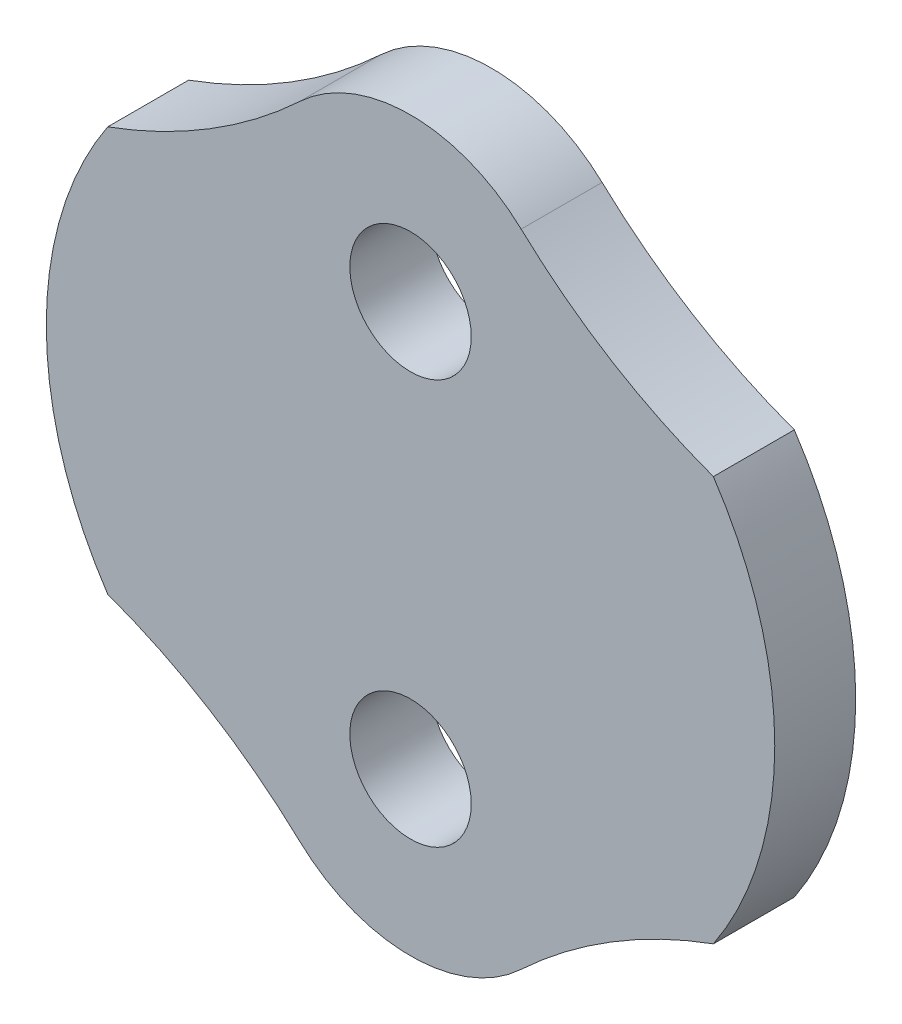
from build123d import *

# Parameters (mm, degrees)
SKETCH1_R           = 14.2875
SKETCH1_R_2         = 2.38125
BOSS_EXTRUDE1_DEPTH = 3.175
SKETCH2_R           = 18.832202279
SKETCH2_R_2         = 14.2875
CUT_EXTRUDE1_DEPTH  = 21.453506729


with BuildPart() as part:
    # Sketch1 → Boss-Extrude1 (new body)
    with BuildSketch(Plane.XY):
        Circle(SKETCH1_R)
        with Locations((0, 7.9375)):
            Circle(SKETCH1_R_2, mode=Mode.SUBTRACT)
        with Locations((0, -7.9375)):
            Circle(SKETCH1_R_2, mode=Mode.SUBTRACT)
    extrude(amount=BOSS_EXTRUDE1_DEPTH)

    # Sketch2 → Cut-Extrude1 (cut, through all)
    # profile 1 of 5: a face of its own
    with BuildSketch(Plane.XY.offset(3.175)):
        Circle(SKETCH2_R)
        Circle(SKETCH2_R_2, mode=Mode.SUBTRACT)
    # profile 2 of 5: a face of its own
    with BuildSketch(Plane.XY.offset(3.175)):
        with BuildLine():
            ThreePointArc((4.340071127, 12.572829828), (7.875864823, 9.874463076), (11.879762203, 7.9375))
            ThreePointArc((11.879762203, 7.9375), (6.735192091, 12.600390619), (0, 14.2875))
            ThreePointArc((0, 14.2875), (2.333254764, 13.843295645), (4.340071127, 12.572829828))
        make_face()
    # profile 3 of 5: a face of its own
    with BuildSketch(Plane.XY.offset(3.175)):
        with BuildLine():
            ThreePointArc((7.3e-08, -14.2875), (6.735192123, -12.600390602), (11.879762203, -7.9375))
            ThreePointArc((11.879762203, -7.9375), (7.875864823, -9.874463076), (4.340071127, -12.572829828))
            ThreePointArc((4.340071127, -12.572829828), (2.333254798, -13.843295632), (7.3e-08, -14.2875))
        make_face()
    # profile 4 of 5: a face of its own
    with BuildSketch(Plane.XY.offset(3.175)):
        with BuildLine():
            ThreePointArc((-11.879762203, -7.9375), (-6.735192059, -12.600390636), (7.3e-08, -14.2875))
            ThreePointArc((7.3e-08, -14.2875), (-2.33325473, -13.843295659), (-4.340071127, -12.572829828))
            ThreePointArc((-4.340071127, -12.572829828), (-7.875864823, -9.874463076), (-11.879762203, -7.9375))
        make_face()
    # profile 5 of 5: a face of its own
    with BuildSketch(Plane.XY.offset(3.175)):
        with BuildLine():
            ThreePointArc((-4.340071127, 12.572829828), (-2.333254764, 13.843295645), (0, 14.2875))
            ThreePointArc((0, 14.2875), (-6.735192091, 12.600390619), (-11.879762203, 7.9375))
            ThreePointArc((-11.879762203, 7.9375), (-7.875864823, 9.874463076), (-4.340071127, 12.572829828))
        make_face()
    extrude(amount=-CUT_EXTRUDE1_DEPTH, mode=Mode.SUBTRACT)


solid = part.part
